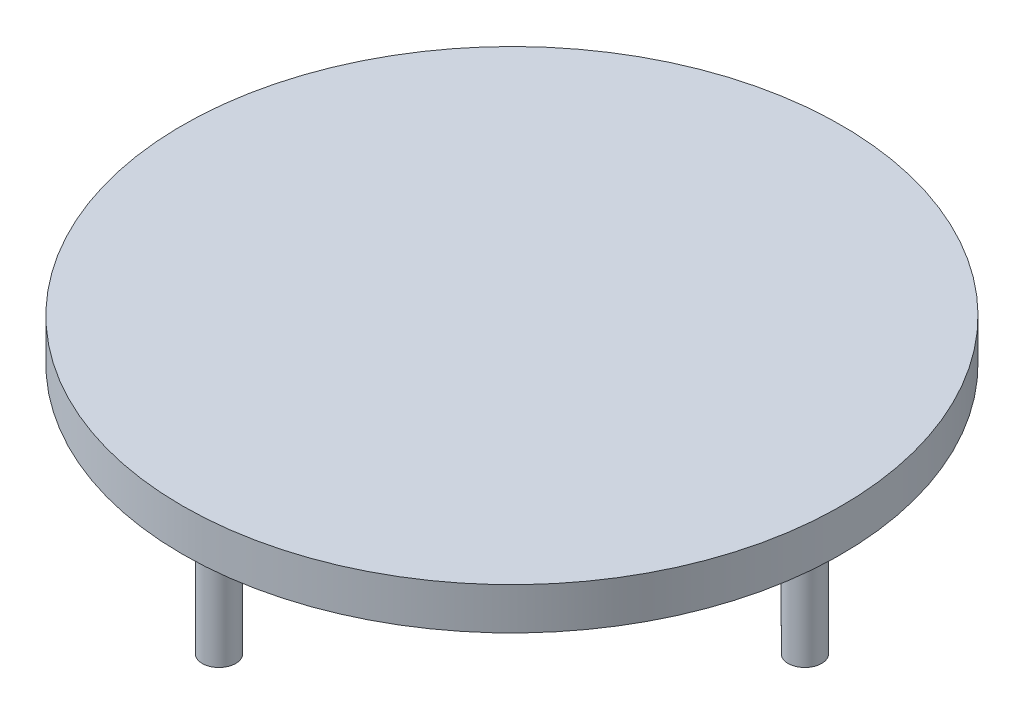
from build123d import *

# Parameters (mm, degrees)
SKETCH7_R           = 15.75
BOSS_EXTRUDE5_DEPTH = 2
SKETCH8_R           = 0.8
BOSS_EXTRUDE6_DEPTH = 5


with BuildPart() as part:
    # Sketch7 → Boss-Extrude5 (new body)
    with BuildSketch(Plane(origin=(0, 0, 0), x_dir=(1, 0, 0), z_dir=(0, 1, 0))):
        with Locations(Location((0, 0, 0), (0, 0, 270))):
            Circle(SKETCH7_R)
    extrude(amount=BOSS_EXTRUDE5_DEPTH)

    # Sketch8 → Boss-Extrude6 (add)
    with BuildSketch(Plane.XZ):
        with Locations(Location((0, 14, 0), (0, 0, 90))):
            Circle(SKETCH8_R)
        with Locations(Location((14, 0, 0), (0, 0, 90))):
            Circle(SKETCH8_R)
        with Locations(Location((0, -14, 0), (0, 0, 90))):
            Circle(SKETCH8_R)
        with Locations(Location((-14, 0, 0), (0, 0, 90))):
            Circle(SKETCH8_R)
    extrude(amount=BOSS_EXTRUDE6_DEPTH)


solid = part.part
